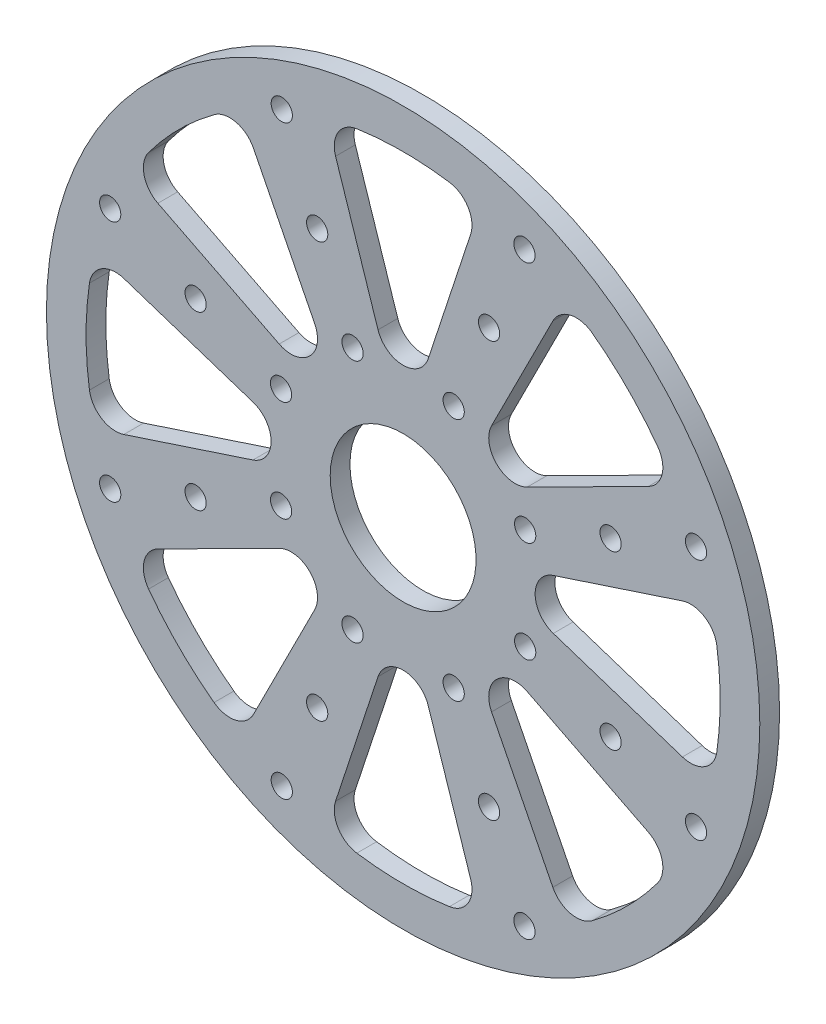
from build123d import *

# Parameters (mm, degrees)
SKETCH1_R           = 85.725
BOSS_EXTRUDE1_DEPTH = 4.7498
SKETCH2_R           = 17.526
SKETCH2_R_2         = 2.5527
CUT_EXTRUDE1_DEPTH  = 122.326468052


with BuildPart() as part:
    # Sketch1 → Boss-Extrude1 (new body)
    with BuildSketch(Plane.XY):
        Circle(SKETCH1_R)
    extrude(amount=BOSS_EXTRUDE1_DEPTH)

    # Sketch2 → Cut-Extrude1 (cut, through all)
    with BuildSketch(Plane(origin=(0, 0, 0), x_dir=(-1, 0, 0), z_dir=(0, 0, -1))):
        Circle(SKETCH2_R)
        with Locations((29.160477546, -70.399620377)):
            Circle(SKETCH2_R_2)
        with Locations((-29.160477546, -70.399620377)):
            Circle(SKETCH2_R_2)
        with Locations((-70.399620377, -29.160477546)):
            Circle(SKETCH2_R_2)
        with Locations((-70.399620377, 29.160477546)):
            Circle(SKETCH2_R_2)
        with Locations((-29.160477546, 70.399620377)):
            Circle(SKETCH2_R_2)
        with Locations((29.160477546, 70.399620377)):
            Circle(SKETCH2_R_2)
        with Locations((70.399620377, 29.160477546)):
            Circle(SKETCH2_R_2)
        with Locations((70.399620377, -29.160477546)):
            Circle(SKETCH2_R_2)
        with Locations((20.655338262, -49.866397767)):
            Circle(SKETCH2_R_2)
        with Locations((12.150198978, -29.333175157)):
            Circle(SKETCH2_R_2)
        with Locations((-20.655338262, -49.866397767)):
            Circle(SKETCH2_R_2)
        with Locations((-12.150198978, -29.333175157)):
            Circle(SKETCH2_R_2)
        with Locations((-49.866397767, -20.655338262)):
            Circle(SKETCH2_R_2)
        with Locations((-29.333175157, -12.150198978)):
            Circle(SKETCH2_R_2)
        with Locations((-49.866397767, 20.655338262)):
            Circle(SKETCH2_R_2)
        with Locations((-29.333175157, 12.150198978)):
            Circle(SKETCH2_R_2)
        with Locations((-20.655338262, 49.866397767)):
            Circle(SKETCH2_R_2)
        with Locations((-12.150198978, 29.333175157)):
            Circle(SKETCH2_R_2)
        with Locations((20.655338262, 49.866397767)):
            Circle(SKETCH2_R_2)
        with Locations((12.150198978, 29.333175157)):
            Circle(SKETCH2_R_2)
        with Locations((49.866397767, 20.655338262)):
            Circle(SKETCH2_R_2)
        with Locations((29.333175157, 12.150198978)):
            Circle(SKETCH2_R_2)
        with Locations((49.866397767, -20.655338262)):
            Circle(SKETCH2_R_2)
        with Locations((29.333175157, -12.150198978)):
            Circle(SKETCH2_R_2)
        with BuildLine():
            Line((-16.235268838, -67.116813488), (-6.032111467, -36.094858891))
            ThreePointArc((-6.032111467, -36.094858891), (0, -31.72882745), (6.032111467, -36.094858891))
            Line((6.032111467, -36.094858891), (16.235268838, -67.116813488))
            ThreePointArc((16.235268838, -67.116813488), (15.605967505, -72.437268621), (11.130717132, -75.382671325))
            ThreePointArc((11.130717132, -75.382671325), (0, -76.2), (-11.130717132, -75.382671325))
            ThreePointArc((-11.130717132, -75.382671325), (-15.605967505, -72.437268621), (-16.235268838, -67.116813488))
        make_face()
        with BuildLine():
            Line((-58.938822639, -35.978685259), (-29.788266411, -21.257572564))
            ThreePointArc((-29.788266411, -21.257572564), (-22.435669049, -22.435669049), (-21.257572564, -29.788266411))
            Line((-21.257572564, -29.788266411), (-35.978685259, -58.938822639))
            ThreePointArc((-35.978685259, -58.938822639), (-40.185798403, -62.255969303), (-45.432992514, -61.174203642))
            ThreePointArc((-45.432992514, -61.174203642), (-53.881536726, -53.881536726), (-61.174203642, -45.432992514))
            ThreePointArc((-61.174203642, -45.432992514), (-62.255969303, -40.185798403), (-58.938822639, -35.978685259))
        make_face()
        with BuildLine():
            Line((-67.116813488, 16.235268838), (-36.094858891, 6.032111467))
            ThreePointArc((-36.094858891, 6.032111467), (-31.72882745, 0), (-36.094858891, -6.032111467))
            Line((-36.094858891, -6.032111467), (-67.116813488, -16.235268838))
            ThreePointArc((-67.116813488, -16.235268838), (-72.437268621, -15.605967505), (-75.382671325, -11.130717132))
            ThreePointArc((-75.382671325, -11.130717132), (-76.2, 0), (-75.382671325, 11.130717132))
            ThreePointArc((-75.382671325, 11.130717132), (-72.437268621, 15.605967505), (-67.116813488, 16.235268838))
        make_face()
        with BuildLine():
            Line((-35.978685259, 58.938822639), (-21.257572564, 29.788266411))
            ThreePointArc((-21.257572564, 29.788266411), (-22.435669049, 22.435669049), (-29.788266411, 21.257572564))
            Line((-29.788266411, 21.257572564), (-58.938822639, 35.978685259))
            ThreePointArc((-58.938822639, 35.978685259), (-62.255969303, 40.185798403), (-61.174203642, 45.432992514))
            ThreePointArc((-61.174203642, 45.432992514), (-53.881536726, 53.881536726), (-45.432992514, 61.174203642))
            ThreePointArc((-45.432992514, 61.174203642), (-40.185798403, 62.255969303), (-35.978685259, 58.938822639))
        make_face()
        with BuildLine():
            Line((16.235268838, 67.116813488), (6.032111467, 36.094858891))
            ThreePointArc((6.032111467, 36.094858891), (0, 31.72882745), (-6.032111467, 36.094858891))
            Line((-6.032111467, 36.094858891), (-16.235268838, 67.116813488))
            ThreePointArc((-16.235268838, 67.116813488), (-15.605967505, 72.437268621), (-11.130717132, 75.382671325))
            ThreePointArc((-11.130717132, 75.382671325), (0, 76.2), (11.130717132, 75.382671325))
            ThreePointArc((11.130717132, 75.382671325), (15.605967505, 72.437268621), (16.235268838, 67.116813488))
        make_face()
        with BuildLine():
            Line((58.938822639, 35.978685259), (29.788266411, 21.257572564))
            ThreePointArc((29.788266411, 21.257572564), (22.435669049, 22.435669049), (21.257572564, 29.788266411))
            Line((21.257572564, 29.788266411), (35.978685259, 58.938822639))
            ThreePointArc((35.978685259, 58.938822639), (40.185798403, 62.255969303), (45.432992514, 61.174203642))
            ThreePointArc((45.432992514, 61.174203642), (53.881536726, 53.881536726), (61.174203642, 45.432992514))
            ThreePointArc((61.174203642, 45.432992514), (62.255969303, 40.185798403), (58.938822639, 35.978685259))
        make_face()
        with BuildLine():
            Line((67.116813488, -16.235268838), (36.094858891, -6.032111467))
            ThreePointArc((36.094858891, -6.032111467), (31.72882745, 0), (36.094858891, 6.032111467))
            Line((36.094858891, 6.032111467), (67.116813488, 16.235268838))
            ThreePointArc((67.116813488, 16.235268838), (72.437268621, 15.605967505), (75.382671325, 11.130717132))
            ThreePointArc((75.382671325, 11.130717132), (76.2, 0), (75.382671325, -11.130717132))
            ThreePointArc((75.382671325, -11.130717132), (72.437268621, -15.605967505), (67.116813488, -16.235268838))
        make_face()
        with BuildLine():
            Line((35.978685259, -58.938822639), (21.257572564, -29.788266411))
            ThreePointArc((21.257572564, -29.788266411), (22.435669049, -22.435669049), (29.788266411, -21.257572564))
            Line((29.788266411, -21.257572564), (58.938822639, -35.978685259))
            ThreePointArc((58.938822639, -35.978685259), (62.255969303, -40.185798403), (61.174203642, -45.432992514))
            ThreePointArc((61.174203642, -45.432992514), (53.881536726, -53.881536726), (45.432992514, -61.174203642))
            ThreePointArc((45.432992514, -61.174203642), (40.185798403, -62.255969303), (35.978685259, -58.938822639))
        make_face()
    extrude(amount=-CUT_EXTRUDE1_DEPTH, mode=Mode.SUBTRACT)


solid = part.part
